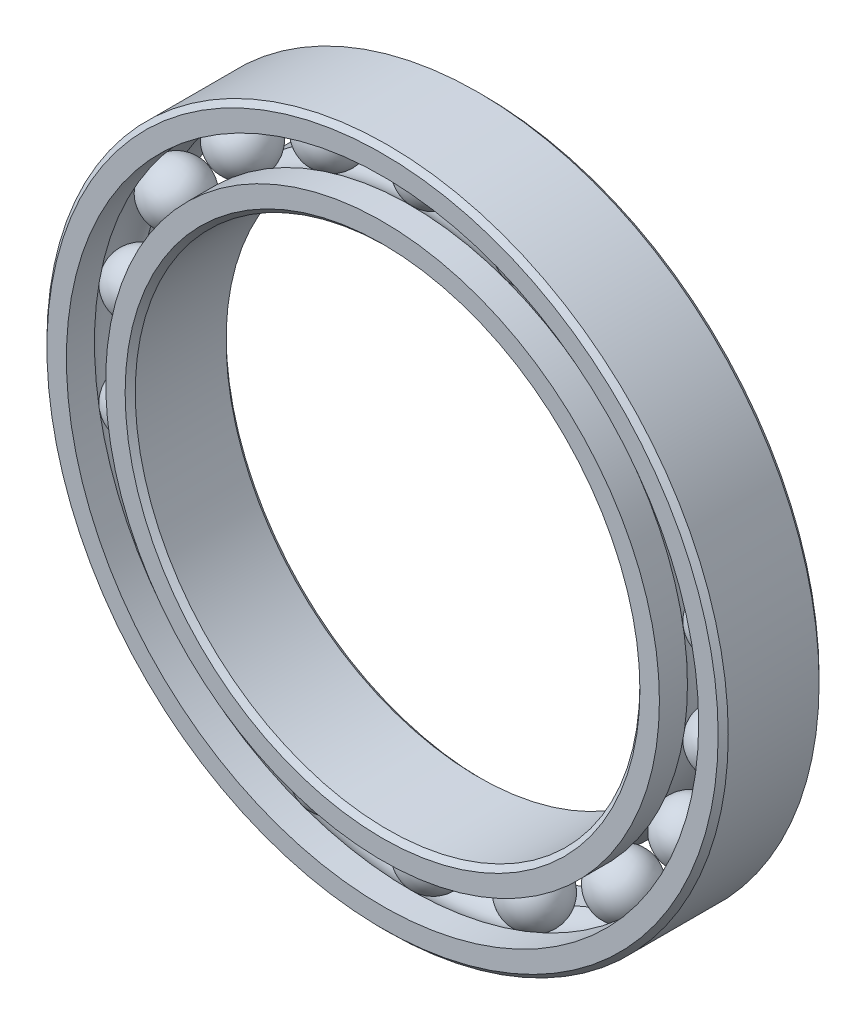
from build123d import *

# Parameters (mm, degrees)
CIRPATTERN1_COUNT = 18


with BuildPart() as part:
    # Sketch5 → Revolve1 (revolve)
    with BuildSketch(Plane(origin=(0, 0, 0), x_dir=(0, 0, -1), z_dir=(1, 0, 0))):
        with BuildLine():
            Line((1.8, 13.5), (-1.8, 13.5))
            Line((-1.8, 13.5), (-2, 13.3))
            Line((-2, 13.3), (-2, 12.527777778))
            Line((-2, 12.527777778), (-0.888888889, 12.527777778))
            ThreePointArc((-0.888888889, 12.527777778), (0, 12.931127313), (0.888888889, 12.527777778))
            Line((0.888888889, 12.527777778), (2, 12.527777778))
            Line((2, 12.527777778), (2, 13.3))
            Line((2, 13.3), (1.8, 13.5))
        make_face()
    revolve(axis=Axis((0, 0, 2), (0, 0, -1)))


with BuildPart() as body_2:
    # Sketch3 → Revolve3 (revolve)
    with BuildSketch(Plane(origin=(0, 0, 0), x_dir=(0, 0, -1), z_dir=(1, 0, 0))):
        with BuildLine():
            Line((-2, 10.972222222), (-0.888888889, 10.972222222))
            ThreePointArc((-0.888888889, 10.972222222), (0, 10.568872687), (0.888888889, 10.972222222))
            Line((0.888888889, 10.972222222), (2, 10.972222222))
            Line((2, 10.972222222), (2, 10.2))
            Line((2, 10.2), (1.8, 10))
            Line((1.8, 10), (-1.8, 10))
            Line((-1.8, 10), (-2, 10.2))
            Line((-2, 10.2), (-2, 10.972222222))
        make_face()
    revolve(axis=Axis((0, 0, 2), (0, 0, -1)))


with BuildPart() as body_3:
    # Sketch4 → Revolve4 (revolve)
    with BuildSketch(Plane(origin=(0, 0, 0), x_dir=(0, 0, -1), z_dir=(1, 0, 0))):
        with BuildLine():
            Line((-1.181127313, 11.75), (1.181127313, 11.75))
            ThreePointArc((1.181127313, 11.75), (0, 12.931127313), (-1.181127313, 11.75))
        make_face()
    revolve(axis=Axis((0, 11.75, 1.181127313), (0, 0, -1)))


with BuildPart() as cirpattern1_1:
    # CirPattern1: pattern copy
    add(body_3.part.rotate(Axis((0, 0, 0), (0, 0, 1)), 1 * 360 / CIRPATTERN1_COUNT))


with BuildPart() as cirpattern1_2:
    # CirPattern1: pattern copy
    add(body_3.part.rotate(Axis((0, 0, 0), (0, 0, 1)), 2 * 360 / CIRPATTERN1_COUNT))


with BuildPart() as cirpattern1_3:
    # CirPattern1: pattern copy
    add(body_3.part.rotate(Axis((0, 0, 0), (0, 0, 1)), 3 * 360 / CIRPATTERN1_COUNT))


with BuildPart() as cirpattern1_4:
    # CirPattern1: pattern copy
    add(body_3.part.rotate(Axis((0, 0, 0), (0, 0, 1)), 4 * 360 / CIRPATTERN1_COUNT))


with BuildPart() as cirpattern1_5:
    # CirPattern1: pattern copy
    add(body_3.part.rotate(Axis((0, 0, 0), (0, 0, 1)), 5 * 360 / CIRPATTERN1_COUNT))


with BuildPart() as cirpattern1_6:
    # CirPattern1: pattern copy
    add(body_3.part.rotate(Axis((0, 0, 0), (0, 0, 1)), 6 * 360 / CIRPATTERN1_COUNT))


with BuildPart() as cirpattern1_7:
    # CirPattern1: pattern copy
    add(body_3.part.rotate(Axis((0, 0, 0), (0, 0, 1)), 7 * 360 / CIRPATTERN1_COUNT))


with BuildPart() as cirpattern1_8:
    # CirPattern1: pattern copy
    add(body_3.part.rotate(Axis((0, 0, 0), (0, 0, 1)), 8 * 360 / CIRPATTERN1_COUNT))


with BuildPart() as cirpattern1_9:
    # CirPattern1: pattern copy
    add(body_3.part.rotate(Axis((0, 0, 0), (0, 0, 1)), 9 * 360 / CIRPATTERN1_COUNT))


with BuildPart() as cirpattern1_10:
    # CirPattern1: pattern copy
    add(body_3.part.rotate(Axis((0, 0, 0), (0, 0, 1)), 10 * 360 / CIRPATTERN1_COUNT))


with BuildPart() as cirpattern1_11:
    # CirPattern1: pattern copy
    add(body_3.part.rotate(Axis((0, 0, 0), (0, 0, 1)), 11 * 360 / CIRPATTERN1_COUNT))


with BuildPart() as cirpattern1_12:
    # CirPattern1: pattern copy
    add(body_3.part.rotate(Axis((0, 0, 0), (0, 0, 1)), 12 * 360 / CIRPATTERN1_COUNT))


with BuildPart() as cirpattern1_13:
    # CirPattern1: pattern copy
    add(body_3.part.rotate(Axis((0, 0, 0), (0, 0, 1)), 13 * 360 / CIRPATTERN1_COUNT))


with BuildPart() as cirpattern1_14:
    # CirPattern1: pattern copy
    add(body_3.part.rotate(Axis((0, 0, 0), (0, 0, 1)), 14 * 360 / CIRPATTERN1_COUNT))


with BuildPart() as cirpattern1_15:
    # CirPattern1: pattern copy
    add(body_3.part.rotate(Axis((0, 0, 0), (0, 0, 1)), 15 * 360 / CIRPATTERN1_COUNT))


with BuildPart() as cirpattern1_16:
    # CirPattern1: pattern copy
    add(body_3.part.rotate(Axis((0, 0, 0), (0, 0, 1)), 16 * 360 / CIRPATTERN1_COUNT))


with BuildPart() as cirpattern1_17:
    # CirPattern1: pattern copy
    add(body_3.part.rotate(Axis((0, 0, 0), (0, 0, 1)), 17 * 360 / CIRPATTERN1_COUNT))


solid = Compound([part.part, body_2.part, body_3.part, cirpattern1_1.part, cirpattern1_2.part, cirpattern1_3.part, cirpattern1_4.part, cirpattern1_5.part, cirpattern1_6.part, cirpattern1_7.part, cirpattern1_8.part, cirpattern1_9.part, cirpattern1_10.part, cirpattern1_11.part, cirpattern1_12.part, cirpattern1_13.part, cirpattern1_14.part, cirpattern1_15.part, cirpattern1_16.part, cirpattern1_17.part])
